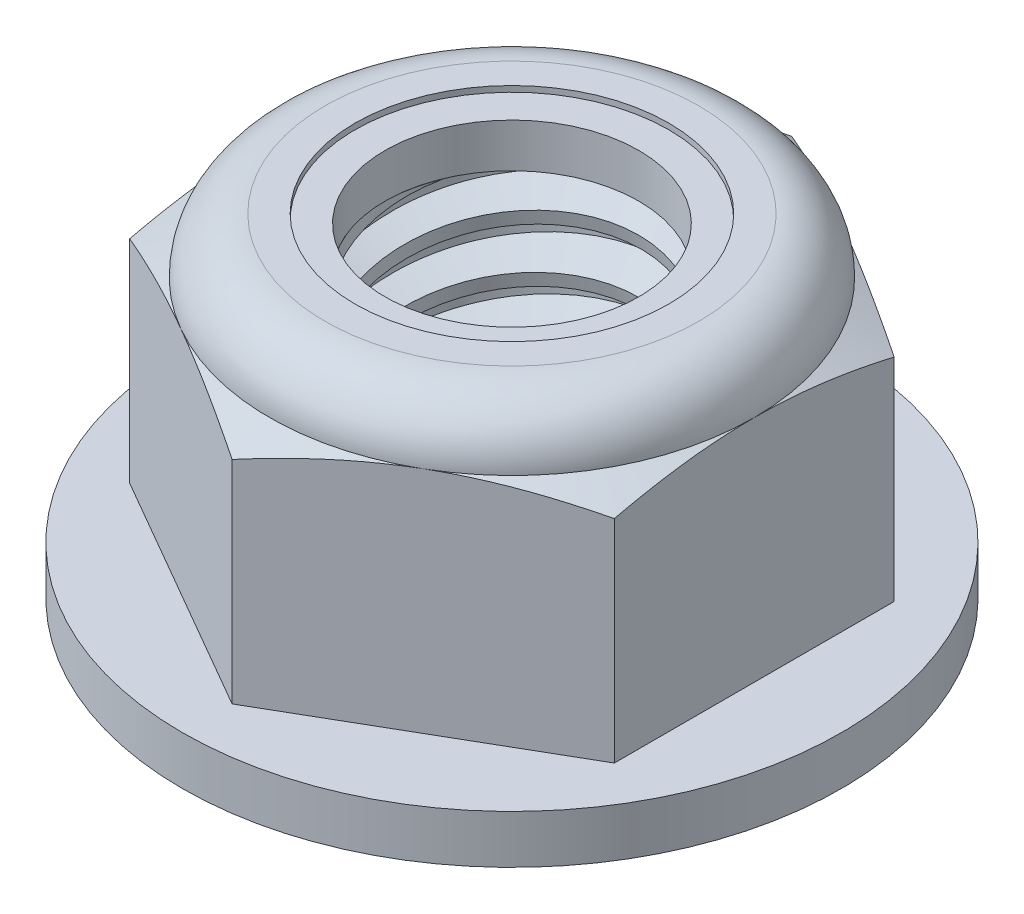
from build123d import *

# Parameters (mm, degrees)
EXTRUDE1_DEPTH       = 8.73125
SKETCH8_W            = 8.636
SKETCH8_H            = 1.27
SKETCH2_W            = 3.96875
SKETCH2_H            = 8.73125
LPATTERN1_COUNT      = 6
LPATTERN1_PITCH      = 1.411111111
LPATTERN1_COUNT_DIR2 = 2
LPATTERN1_PITCH_DIR2 = 1.411111111


with BuildPart() as part:
    # Sketch1 → Extrude1 (new body)
    with BuildSketch(Plane(origin=(0, 0, 0), x_dir=(1, 0, 0), z_dir=(0, 1, 0))):
        Polygon((0, 7.332348419), (-6.35, 3.666174209), (-6.35, -3.666174209), (0, -7.332348419), (6.35, -3.666174209), (6.35, 3.666174209), align=None)
    extrude(amount=EXTRUDE1_DEPTH)

    # Sketch8 → Revolve3 (revolve)
    with BuildSketch(Plane(origin=(0, 0, 0), x_dir=(0, 0, -1), z_dir=(1, 0, 0))):
        with Locations((4.318, 0.635)):
            Rectangle(SKETCH8_W, SKETCH8_H)
    revolve(axis=Axis((0, 0, 0), (0, -1, 0)))

    # Sketch4 → Cut-Revolve2 (revolve, cut)
    with BuildSketch(Plane(origin=(0, 0, 0), x_dir=(0, 0, -1), z_dir=(1, 0, 0))):
        Polygon((0, 8.73125), (3.96875, 8.73125), (3.324813425, 8.430977444), (3.324813425, 0.300272556), (3.96875, 0), (0, 0), align=None)
    revolve(axis=Axis((0, 8.73125, 0), (0, 1, 0)), mode=Mode.SUBTRACT)


with BuildPart() as body_2:
    # Sketch2 → Revolve1 (revolve)
    with BuildSketch(Plane(origin=(0, 0, 0), x_dir=(0, 0, -1), z_dir=(1, 0, 0))):
        with Locations((1.984375, 4.365625)):
            Rectangle(SKETCH2_W, SKETCH2_H)
    revolve(axis=Axis((0, -3.96875, 0), (0, 1, 0)))

    # Sketch3 → Cut-Revolve1 (revolve, cut)
    with BuildSketch(Plane(origin=(0, 0, 0), x_dir=(0, 0, -1), z_dir=(1, 0, 0))):
        Polygon((3.999623935, 8.557584113), (4.215741483, 7.341922906), (3.386561296, 7.642399561), (3.324813425, 7.989731334), align=None)
    cut_revolve1 = revolve(axis=Axis((0, 8.73125, 0.268755768), (0, -0.9845625077859066, -0.17503333471749472)), mode=Mode.SUBTRACT)

    # LPattern1: Cut-Revolve1 6 × 2
    with Locations(*[Vector(0, -1, 0) * (i * LPATTERN1_PITCH) + Vector(0, 1, 0) * (j * LPATTERN1_PITCH_DIR2) for i in range(LPATTERN1_COUNT) for j in range(LPATTERN1_COUNT_DIR2) if (i, j) != (0, 0)]):
        add(cut_revolve1, mode=Mode.SUBTRACT)


with BuildPart() as part_1:
    add(part.part)

    # Combine1: cut body 2
    add(body_2.part, mode=Mode.SUBTRACT)

    # Sketch5 → Cut-Revolve3 (revolve, cut)
    with BuildSketch(Plane(origin=(0, 0, 0), x_dir=(0, 0, -1), z_dir=(1, 0, 0))):
        with BuildLine():
            Line((7.332348419, 1.27), (7.332348419, 6.817965076))
            Line((7.332348419, 6.817965076), (6.35, 7.276041667))
            ThreePointArc((6.35, 7.276041667), (5.923779347, 8.305029347), (4.894791667, 8.73125))
            Line((4.894791667, 8.73125), (4.894791667, 10.00125))
            Line((4.894791667, 10.00125), (8.602348419, 10.00125))
            Line((8.602348419, 10.00125), (8.602348419, 1.27))
            Line((8.602348419, 1.27), (7.332348419, 1.27))
        make_face()
    revolve(axis=Axis((0, 0, 0), (0, 1, 0)), mode=Mode.SUBTRACT)

    # Sketch6 → Cut-Revolve4 (revolve, cut)
    with BuildSketch(Plane(origin=(0, 0, 0), x_dir=(0, 0, -1), z_dir=(1, 0, 0))):
        with BuildLine():
            Line((0, 7.276041667), (6.1976, 7.276041667))
            ThreePointArc((6.1976, 7.276041667), (5.816016274, 8.197266274), (4.894791667, 8.57885))
            Line((4.894791667, 8.57885), (4.109802546, 8.57885))
            Line((4.109802546, 8.57885), (4.109802546, 10.00125))
            Line((4.109802546, 10.00125), (0, 10.00125))
            Line((0, 10.00125), (0, 7.276041667))
        make_face()
    revolve(axis=Axis((0, 10.00125, 0), (0, 1, 0)), mode=Mode.SUBTRACT)


with BuildPart() as body_2_2:
    # Sketch7 → Revolve2 (revolve)
    with BuildSketch(Plane(origin=(0, 0, 0), x_dir=(0, 0, -1), z_dir=(1, 0, 0))):
        with BuildLine():
            Line((3.324813425, 7.352241667), (6.119030844, 7.352241667))
            ThreePointArc((6.119030844, 7.352241667), (5.734762038, 8.169919611), (4.894791667, 8.50265))
            Line((4.894791667, 8.50265), (3.324813425, 8.50265))
            Line((3.324813425, 8.50265), (3.324813425, 7.352241667))
        make_face()
    revolve(axis=Axis((0, 7.352241667, 0), (0, 1, 0)))


solid = Compound([part_1.part, body_2_2.part])
